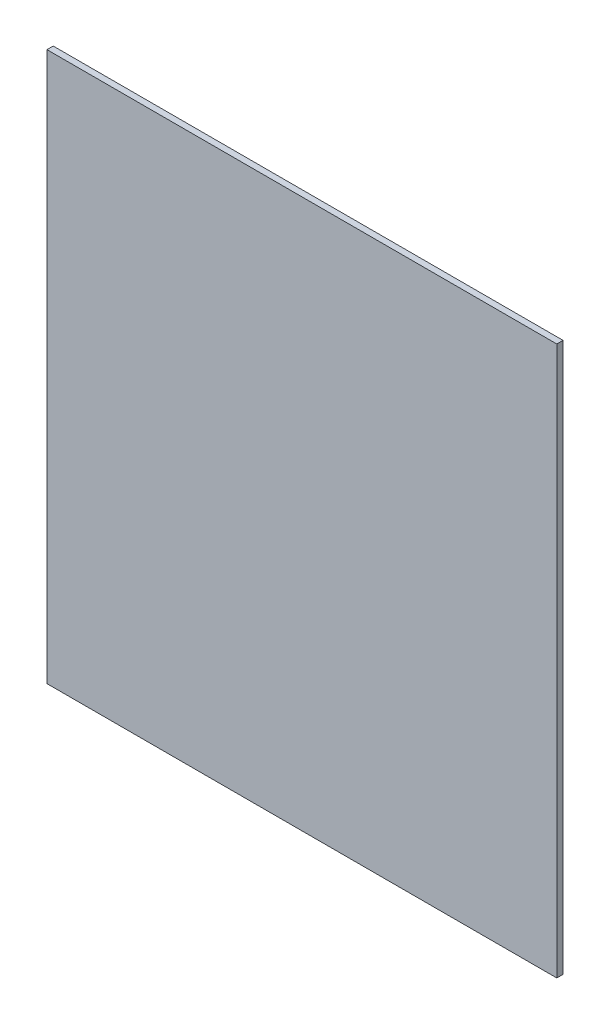
from build123d import *

# Parameters (mm, degrees)
SKETCH1_W           = 65
SKETCH1_H           = 70
BOSS_EXTRUDE1_DEPTH = 0.8


with BuildPart() as part:
    # Sketch1 → Boss-Extrude1 (new body)
    with BuildSketch(Plane.XY):
        with Locations((-20.708808224, -18.5)):
            Rectangle(SKETCH1_W, SKETCH1_H)
    extrude(amount=BOSS_EXTRUDE1_DEPTH)


solid = part.part
